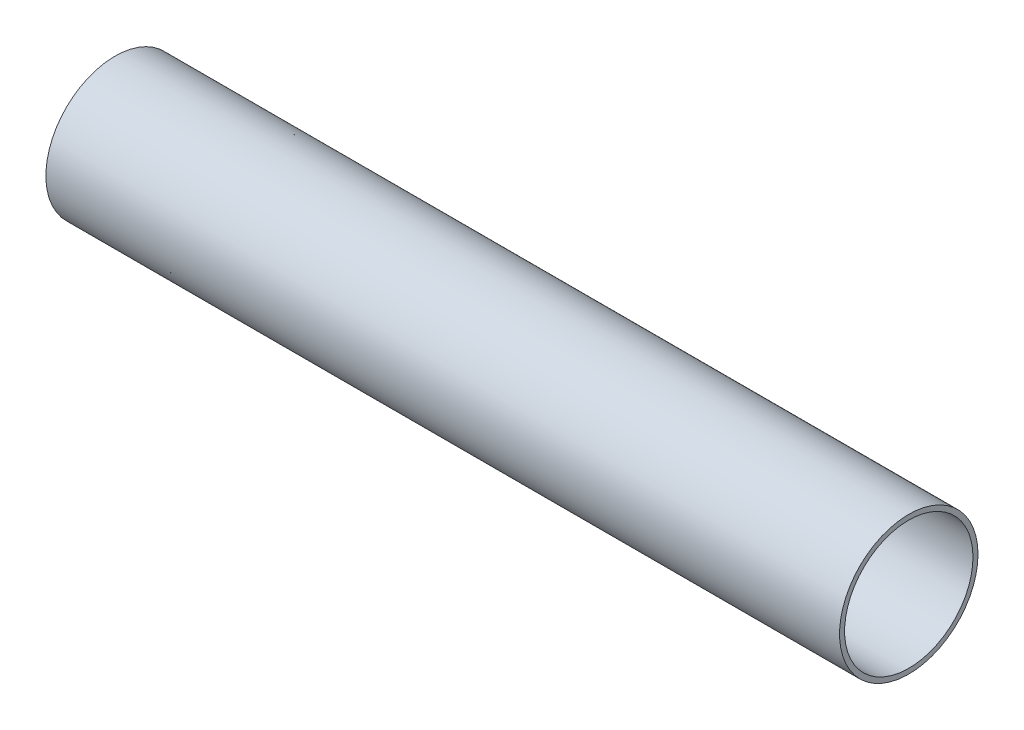
from build123d import *

# Parameters (mm, degrees)
SKETCH1_R           = 37.6555
SKETCH1_R_2         = 34.925
BOSS_EXTRUDE1_DEPTH = 431.8
SKETCH3_W           = 0.9906
SKETCH3_H           = 0.9652


with BuildPart() as part:
    # Sketch1 → Boss-Extrude1 (new body)
    with BuildSketch(Plane(origin=(0, 0, 0), x_dir=(0, 0, -1), z_dir=(1, 0, 0))):
        Circle(SKETCH1_R)
        Circle(SKETCH1_R_2, mode=Mode.SUBTRACT)
    extrude(amount=-BOSS_EXTRUDE1_DEPTH)

    # Sketch3 → Z-92479A230 Snap Ring Groove (revolve, cut)
    with BuildSketch(Plane.XY, mode=Mode.PRIVATE) as z_92479a230_snap_ring_groove_sk:
        with Locations((-405.1173, 35.4076)):
            Rectangle(SKETCH3_W, SKETCH3_H)
    revolve(z_92479a230_snap_ring_groove_sk.sketch.rotate(Axis((-431.8, 0, 0), (1, 0, 0)), 270), axis=Axis((-431.8, 0, 0), (1, 0, 0)), mode=Mode.SUBTRACT)


solid = part.part
